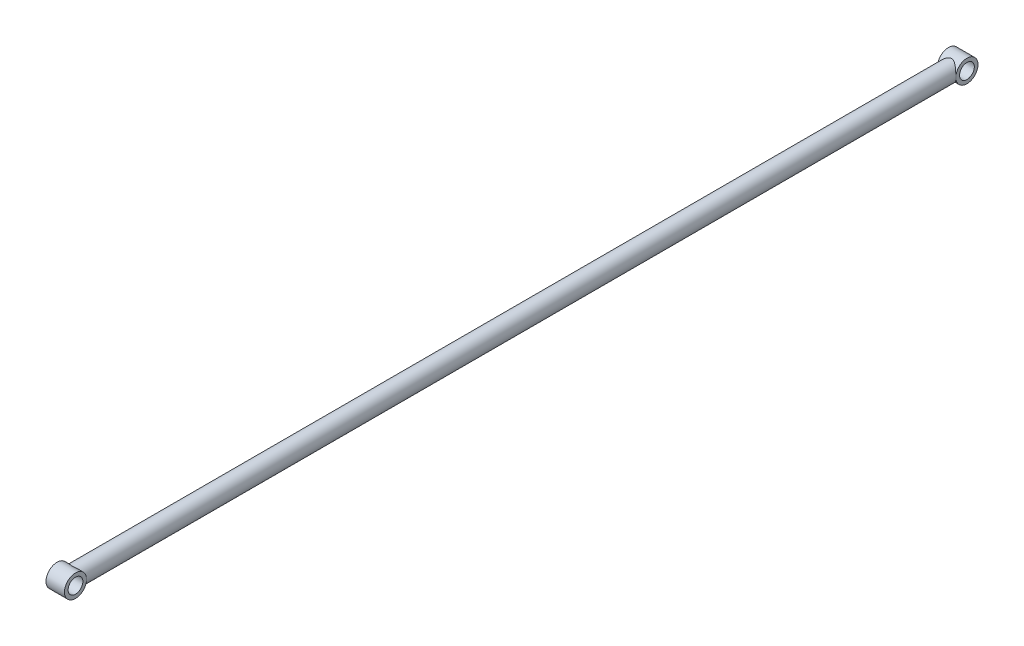
from build123d import *

# Parameters (mm, degrees)
SKETCH3_R           = 5
BOSS_EXTRUDE1_DEPTH = 483
SKETCH4_R           = 6
BOSS_EXTRUDE2_DEPTH = 5
SKETCH5_R           = 4
SKETCH5_R_2         = 3.999944286
CUT_EXTRUDE1_DEPTH  = 12


with BuildPart() as part:
    # Sketch3 → Boss-Extrude1 (new body)
    with BuildSketch(Plane.XY):
        Circle(SKETCH3_R)
    extrude(amount=BOSS_EXTRUDE1_DEPTH)

    # Sketch4 → Boss-Extrude2 (add, symmetric)
    with BuildSketch(Plane(origin=(0, 0, 0), x_dir=(0, 0, -1), z_dir=(1, 0, 0))):
        with Locations((-483, 0)):
            Circle(SKETCH4_R)
        Circle(SKETCH4_R)
    extrude(amount=BOSS_EXTRUDE2_DEPTH, both=True)

    # Sketch5 → Cut-Extrude1 (cut)
    with BuildSketch(Plane(origin=(5, 0, 0), x_dir=(0, 0, -1), z_dir=(1, 0, 0))):
        with Locations((-483, 0)):
            Circle(SKETCH5_R)
        Circle(SKETCH5_R_2)
    extrude(amount=-CUT_EXTRUDE1_DEPTH, mode=Mode.SUBTRACT)


solid = part.part
